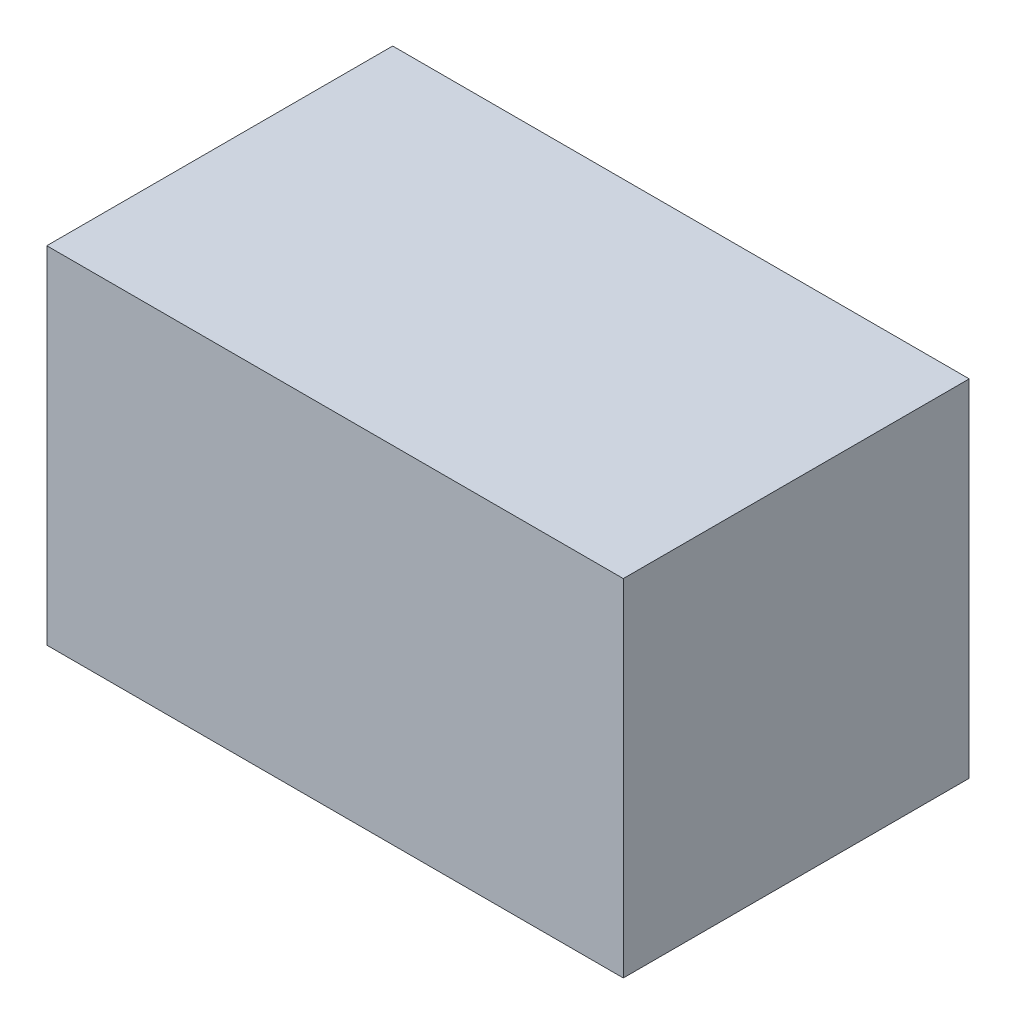
from build123d import *

# Parameters (mm, degrees)
SKETCH_1_W      = 50
SKETCH_1_H      = 30
EXTRUDE_1_DEPTH = 30


with BuildPart() as part:
    # 스케치1 → 보스-돌출1 (new body)
    with BuildSketch(Plane.XY):
        Rectangle(SKETCH_1_W, SKETCH_1_H)
    extrude(amount=EXTRUDE_1_DEPTH)


solid = part.part
